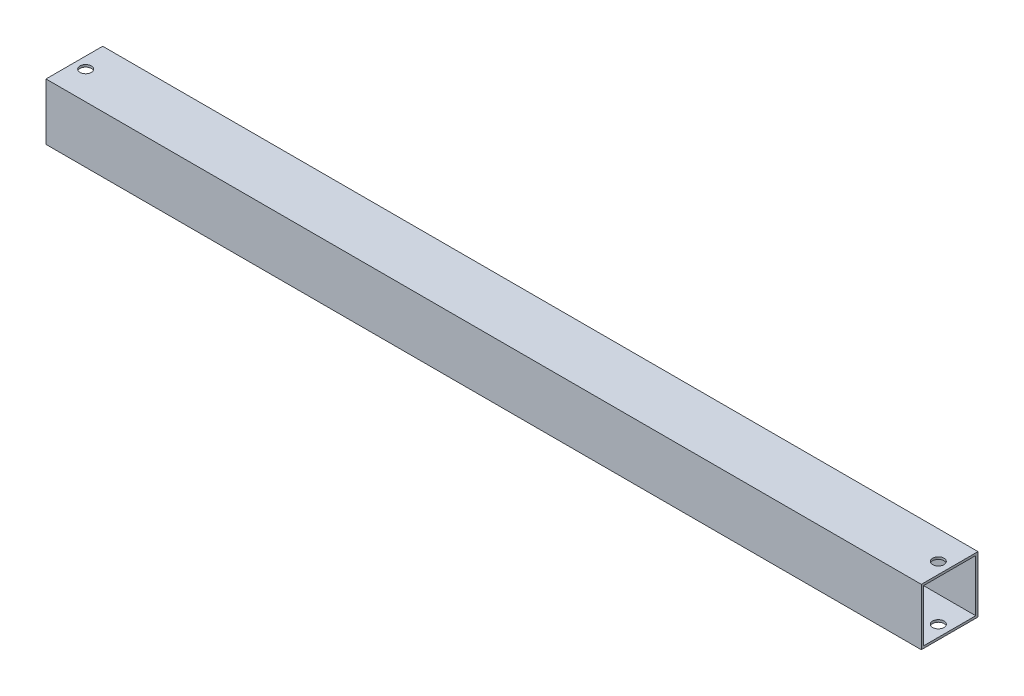
from build123d import *

# Parameters (mm, degrees)
SKETCH1_W           = 25
SKETCH1_H           = 25
SKETCH1_W_2         = 23
SKETCH1_H_2         = 23
BOSS_EXTRUDE1_DEPTH = 386
SKETCH2_R           = 2.5
CUT_EXTRUDE1_DEPTH  = 388.010658768


with BuildPart() as part:
    # Sketch1 → Boss-Extrude1 (new body)
    with BuildSketch(Plane(origin=(0, 0, 0), x_dir=(0, 0, -1), z_dir=(1, 0, 0))):
        Rectangle(SKETCH1_W, SKETCH1_H)
        Rectangle(SKETCH1_W_2, SKETCH1_H_2, mode=Mode.SUBTRACT)
    extrude(amount=BOSS_EXTRUDE1_DEPTH)

    # Sketch2 → Cut-Extrude1 (cut, through all)
    with BuildSketch(Plane(origin=(0, 12.5, 0), x_dir=(1, 0, 0), z_dir=(0, 1, 0))):
        with Locations(Location((5, 0, 0), (0, 0, 270))):
            Circle(SKETCH2_R)
        with Locations(Location((381, 0, 0), (0, 0, 270))):
            Circle(SKETCH2_R)
    extrude(amount=-CUT_EXTRUDE1_DEPTH, mode=Mode.SUBTRACT)


solid = part.part
